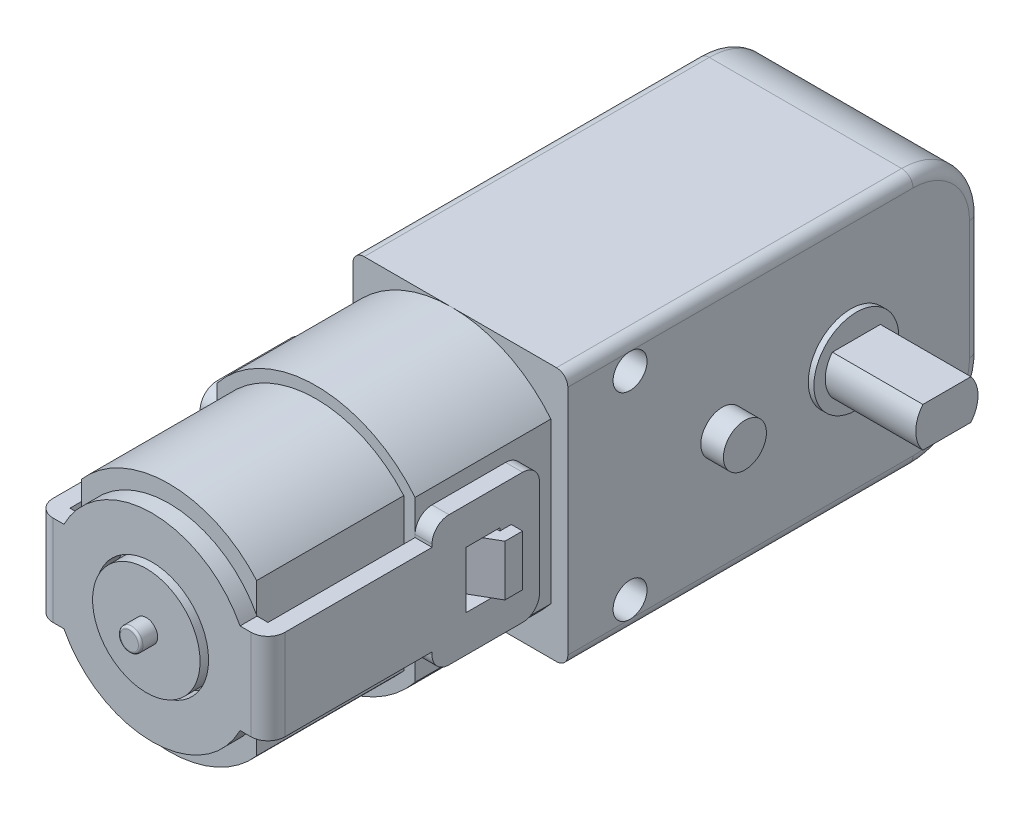
from build123d import *

# Parameters (mm, degrees)
ESBO_O1_W                 = 36.5
ESBO_O1_H                 = 22.5
RESSALTO_EXTRUS_O1_DEPTH  = 9.5
FILETE1_R                 = 6
RESSALTO_EXTRUS_O2_DEPTH  = 12
RESSALTO_EXTRUS_O3_DEPTH  = 13
ESBO_O4_R                 = 3.75
RESSALTO_EXTRUS_O4_DEPTH  = 0.5
ESBO_O5_W                 = 9.5
ESBO_O5_H                 = 11.5
RESSALTO_EXTRUS_O5_DEPTH  = 1.5
ESBO_O6_W                 = 1.5
ESBO_O6_H                 = 8
RESSALTO_EXTRUS_O6_DEPTH  = 13
ESBO_O8_R                 = 4.75
RESSALTO_EXTRUS_O7_DEPTH  = 2
ESBO_O7_R                 = 5
RESSALTO_EXTRUS_O8_DEPTH  = 1.5
ESBO_O10_W                = 1.5
ESBO_O10_H                = 8
RESSALTO_EXTRUS_O9_DEPTH  = 13
ESBO_O11_W                = 1.5
ESBO_O11_H                = 11.5
RESSALTO_EXTRUS_O10_DEPTH = 9.5
FILETE2_R                 = 1.5
ESBO_O12_W                = 3
ESBO_O12_H                = 5
CORTE_EXTRUS_O1_DEPTH     = 58.015896906
RESSALTO_EXTRUS_O11_DEPTH = 2.25
ESBO_O15_R                = 1
RESSALTO_EXTRUS_O12_DEPTH = 1.5
RESSALTO_EXTRUS_O13_DEPTH = 8
FILETE4_R                 = 1
ESBO_O17_R                = 1.5
CORTE_EXTRUS_O2_DEPTH     = 59.745744527
ESBO_O19_R                = 1.5
RESSALTO_EXTRUS_O14_DEPTH = 1.5
FILETE5_R                 = 1
FILETE6_R                 = 0.2
SKETCH3_R                 = 1.9
BOSS_EXTRUDE1_DEPTH       = 2


with BuildPart() as part:
    # Esboço1 → Ressalto-extrusão1 (new, symmetric)
    with BuildSketch(Plane(origin=(0, 0, 0), x_dir=(0, 0, -1), z_dir=(1, 0, 0))):
        with Locations((-6.75, 0)):
            Rectangle(ESBO_O1_W, ESBO_O1_H)
    extrude(amount=RESSALTO_EXTRUS_O1_DEPTH, both=True)

    # Filete1
    filete1_edges = [part.edges().sort_by_distance(p)[0] for p in [
        (0, -11.25, -11.5),
        (0, 11.25, -11.5),
    ]]
    fillet(filete1_edges, radius=FILETE1_R)

    # Esboço2 → Ressalto-extrusão2 (add)
    with BuildSketch(Plane.XY.offset(25)):
        with BuildLine():
            Line((8, 7.071067812), (8, -7.071067812))
            ThreePointArc((8, -7.071067812), (-0.75, -11.25), (-9.5, -7.071067812))
            Line((-9.5, -7.071067812), (-9.5, 7.071067812))
            ThreePointArc((-9.5, 7.071067812), (-0.75, 11.25), (8, 7.071067812))
        make_face()
    extrude(amount=RESSALTO_EXTRUS_O2_DEPTH)

    # Esboço3 → Ressalto-extrusão3 (add)
    with BuildSketch(Plane.XY.offset(37)):
        with BuildLine():
            Line((-8.5, 6.708203932), (-8.5, -6.708203932))
            ThreePointArc((-8.5, -6.708203932), (-0.75, -10.25), (7, -6.708203932))
            Line((7, -6.708203932), (7, 6.708203932))
            ThreePointArc((7, 6.708203932), (-0.75, 10.25), (-8.5, 6.708203932))
        make_face()
    extrude(amount=RESSALTO_EXTRUS_O3_DEPTH)

    # Esboço4 → Ressalto-extrusão4 (add)
    with BuildSketch(Plane(origin=(9.5, 0, 0), x_dir=(0, 0, -1), z_dir=(1, 0, 0))):
        with Locations(Location((0, 0, 0), (0, 0, 180))):
            Circle(ESBO_O4_R)
    ressalto_extrus_o4 = extrude(amount=RESSALTO_EXTRUS_O4_DEPTH)

    # Esboço8 → Ressalto-extrusão7 (add)
    with BuildSketch(Plane.XY.offset(50)):
        with Locations((-0.75, 0)):
            Circle(ESBO_O8_R)
    extrude(amount=RESSALTO_EXTRUS_O7_DEPTH)

    # Esboço14 → Ressalto-extrusão11 (add, symmetric)
    with BuildSketch(Plane(origin=(0, 0, 0), x_dir=(1, 0, 0), z_dir=(0, 1, 0))):
        Polygon((8, -33), (10.5, -31.556624327), (10.5, -30), (9.5, -30), (9.5, -31), (8, -31), align=None)
    ressalto_extrus_o11 = extrude(amount=RESSALTO_EXTRUS_O11_DEPTH, both=True)

    # Espelhar6: Ressalto-extrusão11 across plane
    add(ressalto_extrus_o11.mirror(Plane(origin=(-0.75, 8.75, 51.5), x_dir=(0, 0, 1), z_dir=(-1, 0, 0))))

    # Esboço15 → Ressalto-extrusão12 (add)
    with BuildSketch(Plane.XY.offset(52)):
        with Locations((-0.75, 0)):
            Circle(ESBO_O15_R)
    extrude(amount=RESSALTO_EXTRUS_O12_DEPTH)

    # Esboço16 → Ressalto-extrusão13 (add)
    with BuildSketch(Plane(origin=(10, 0, 0), x_dir=(0, 0, -1), z_dir=(1, 0, 0))):
        with BuildLine():
            Line((-2.121320344, 1.75), (2.121320344, 1.75))
            ThreePointArc((2.121320344, 1.75), (2.75, 0), (2.121320344, -1.75))
            Line((2.121320344, -1.75), (-2.121320344, -1.75))
            ThreePointArc((-2.121320344, -1.75), (-2.75, 0), (-2.121320344, 1.75))
        make_face()
    ressalto_extrus_o13 = extrude(amount=RESSALTO_EXTRUS_O13_DEPTH)

    # Filete4
    filete4_edges = [part.edges().sort_by_distance(p)[0] for p in [
        (-9.5, -11.25, 9.75),
        (-9.5, -9.492640687, -9.742640687),
        (-9.5, 0, -11.5),
        (-9.5, 9.492640687, -9.742640687),
        (9.5, -11.25, 9.75),
        (9.5, -9.492640687, -9.742640687),
        (9.5, 0, -11.5),
        (9.5, 9.492640687, -9.742640687),
        (-9.5, 11.25, 9.75),
        (9.5, 11.25, 9.75),
    ]]
    fillet(filete4_edges, radius=FILETE4_R)

    # Esboço17 → Corte-extrusão2 (cut, through all)
    with BuildSketch(Plane(origin=(9.5, 0, 0), x_dir=(0, 0, -1), z_dir=(1, 0, 0))):
        with Locations(Location((-19.5, 8.75, 0), (0, 0, 90))):
            Circle(ESBO_O17_R)
        with Locations(Location((-19.5, -8.75, 0), (0, 0, 270))):
            Circle(ESBO_O17_R)
    extrude(amount=-CORTE_EXTRUS_O2_DEPTH, mode=Mode.SUBTRACT)

    # Esboço19 → Ressalto-extrusão14 (add, symmetric)
    with BuildSketch(Plane(origin=(0, 0, 0), x_dir=(0, 0, -1), z_dir=(1, 0, 0))):
        with BuildLine():
            Line((11.5, 3), (14.450819672, 2.459016393))
            ThreePointArc((14.450819672, 2.459016393), (16.5, 0), (14.450819672, -2.459016393))
            Line((14.450819672, -2.459016393), (11.5, -3))
            Line((11.5, -3), (11.5, 3))
        make_face()
        with Locations((14, 0)):
            Circle(ESBO_O19_R, mode=Mode.SUBTRACT)
    extrude(amount=RESSALTO_EXTRUS_O14_DEPTH, both=True)

    # Filete5
    filete5_edges = [part.edges().sort_by_distance(p)[0] for p in [
        (0, 3, -11.5),
        (0, -3, -11.5),
    ]]
    fillet(filete5_edges, radius=FILETE5_R)

    # Filete6
    filete6_edges = [part.edges().sort_by_distance(p)[0] for p in [
        (-1.75, 0, 53.5),
    ]]
    fillet(filete6_edges, radius=FILETE6_R)

    # Sketch3 → Boss-Extrude1 (add)
    with BuildSketch(Plane(origin=(9.5, 0, 0), x_dir=(0, 0, -1), z_dir=(1, 0, 0))):
        with Locations(Location((-11.35, 0, 0), (0, 0, 180))):
            Circle(SKETCH3_R)
    extrude(amount=BOSS_EXTRUDE1_DEPTH)

    # Mirror1: Ressalto-extrusão4, Ressalto-extrusão13 across plane
    add(ressalto_extrus_o4.mirror(Plane(origin=(0, 0, 0), x_dir=(0, 0, 1), z_dir=(1, 0, 0))))
    add(ressalto_extrus_o13.mirror(Plane(origin=(0, 0, 0), x_dir=(0, 0, 1), z_dir=(1, 0, 0))))


with BuildPart() as body_2:
    # Esboço5 → Ressalto-extrusão5 (new body)
    with BuildSketch(Plane(origin=(8, 0, 0), x_dir=(0, 0, -1), z_dir=(1, 0, 0))):
        with Locations((-32.25, 0)):
            Rectangle(ESBO_O5_W, ESBO_O5_H)
    extrude(amount=RESSALTO_EXTRUS_O5_DEPTH)

    # Esboço6 → Ressalto-extrusão6 (add)
    with BuildSketch(Plane.XY.offset(37)):
        with Locations((8.75, 0)):
            Rectangle(ESBO_O6_W, ESBO_O6_H)
    extrude(amount=RESSALTO_EXTRUS_O6_DEPTH)

    # Esboço7 → Ressalto-extrusão8 (add)
    with BuildSketch(Plane.XY.offset(50)):
        with BuildLine():
            Line((9.5, 4), (7.032191208, 4))
            ThreePointArc((7.032191208, 4), (-0.75, 8.75), (-8.532191208, 4))
            Line((-8.532191208, 4), (-11, 4))
            Line((-11, 4), (-11, -4))
            Line((-11, -4), (-8.532191208, -4))
            ThreePointArc((-8.532191208, -4), (-0.75, -8.75), (7.032191208, -4))
            Line((7.032191208, -4), (9.5, -4))
            Line((9.5, -4), (9.5, 4))
        make_face()
        with Locations((-0.75, 0)):
            Circle(ESBO_O7_R, mode=Mode.SUBTRACT)
    extrude(amount=RESSALTO_EXTRUS_O8_DEPTH)

    # Esboço10 → Ressalto-extrusão9 (add)
    with BuildSketch(Plane(origin=(0, 0, 50), x_dir=(-1, 0, 0), z_dir=(0, 0, -1))):
        with Locations((10.25, 0)):
            Rectangle(ESBO_O10_W, ESBO_O10_H)
    extrude(amount=RESSALTO_EXTRUS_O9_DEPTH)

    # Esboço11 → Ressalto-extrusão10 (add)
    with BuildSketch(Plane(origin=(0, 0, 37), x_dir=(-1, 0, 0), z_dir=(0, 0, -1))):
        with Locations((10.25, 0)):
            Rectangle(ESBO_O11_W, ESBO_O11_H)
    extrude(amount=RESSALTO_EXTRUS_O10_DEPTH)

    # Filete2
    filete2_edges = [body_2.edges().sort_by_distance(p)[0] for p in [
        (8.75, -5.75, 37),
        (8.75, -5.75, 27.5),
        (8.75, 5.75, 27.5),
        (8.75, 5.75, 37),
        (9.5, 0, 51.5),
        (-11, 0, 51.5),
        (-10.25, -5.75, 27.5),
        (-10.25, -5.75, 37),
        (-10.25, 5.75, 37),
        (-10.25, 5.75, 27.5),
    ]]
    fillet(filete2_edges, radius=FILETE2_R)

    # Esboço12 → Corte-extrusão1 (cut, through all)
    with BuildSketch(Plane(origin=(9.5, 0, 0), x_dir=(0, 0, -1), z_dir=(1, 0, 0))):
        with Locations((-32.5, 0)):
            Rectangle(ESBO_O12_W, ESBO_O12_H)
    extrude(amount=-CORTE_EXTRUS_O1_DEPTH, mode=Mode.SUBTRACT)


solid = Compound([part.part, body_2.part])
